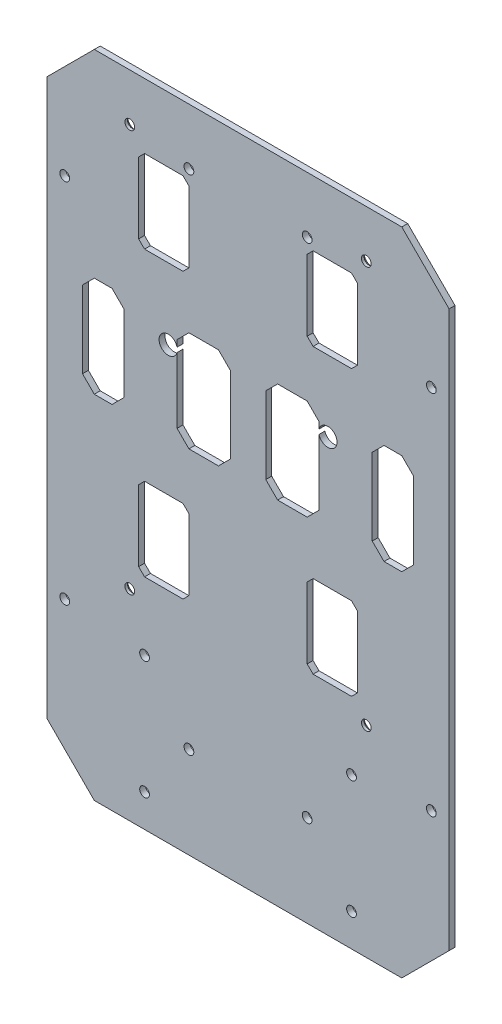
from build123d import *

# Parameters (mm, degrees)
SKETCH_6_R               = 1.65
EXTRUDE_401_DEPTH        = 2
SKETCH_7_R               = 3.1
CUT_EXTRUDE_474_DEPTH    = 2
SKETCH_8_R               = 2.75
D5P5_1P1_DEPTH           = 1.1
D5P5_1P1_DRAFT           = 45
D5P5_1P1_PROFILE_2_DEPTH = 1.1
D5P5_1P1_PROFILE_2_DRAFT = 45
D5P5_1P1_PROFILE_3_DEPTH = 1.1
D5P5_1P1_PROFILE_3_DRAFT = 45
D5P5_1P1_PROFILE_4_DEPTH = 1.1
D5P5_1P1_PROFILE_4_DRAFT = 45


with BuildPart() as part:
    # 草图6 → Extrude 401 (new body)
    with BuildSketch(Plane.XY):
        Polygon((-52, -116), (52, -116), (68, -100), (68, 88), (52, 104), (-52, 104), (-68, 88), (-68, -100), align=None)
        with Locations((-20, -85)):
            Circle(SKETCH_6_R, mode=Mode.SUBTRACT)
        with Locations((-62, -62)):
            Circle(SKETCH_6_R, mode=Mode.SUBTRACT)
        with Locations((-40, -48)):
            Circle(SKETCH_6_R, mode=Mode.SUBTRACT)
        with Locations((-35, -105)):
            Circle(SKETCH_6_R, mode=Mode.SUBTRACT)
        with Locations((-20, 85)):
            Circle(SKETCH_6_R, mode=Mode.SUBTRACT)
        with Locations((-62, 62)):
            Circle(SKETCH_6_R, mode=Mode.SUBTRACT)
        with Locations((-40, 88)):
            Circle(SKETCH_6_R, mode=Mode.SUBTRACT)
        with Locations((-35, -65)):
            Circle(SKETCH_6_R, mode=Mode.SUBTRACT)
        with Locations((20, -85)):
            Circle(SKETCH_6_R, mode=Mode.SUBTRACT)
        with Locations((62, -62)):
            Circle(SKETCH_6_R, mode=Mode.SUBTRACT)
        with Locations((40, -48)):
            Circle(SKETCH_6_R, mode=Mode.SUBTRACT)
        with Locations((35, -105)):
            Circle(SKETCH_6_R, mode=Mode.SUBTRACT)
        with Locations((20, 85)):
            Circle(SKETCH_6_R, mode=Mode.SUBTRACT)
        with Locations((62, 62)):
            Circle(SKETCH_6_R, mode=Mode.SUBTRACT)
        with Locations((40, 88)):
            Circle(SKETCH_6_R, mode=Mode.SUBTRACT)
        with Locations((35, -65)):
            Circle(SKETCH_6_R, mode=Mode.SUBTRACT)
        Polygon((-35, -42), (-22, -42), (-20, -40), (-20, -16), (-22, -14), (-35, -14), (-37, -16), (-37, -40), align=None, mode=Mode.SUBTRACT)
        Polygon((-35, 54), (-22, 54), (-20, 56), (-20, 80), (-22, 82), (-35, 82), (-37, 80), (-37, 56), align=None, mode=Mode.SUBTRACT)
        Polygon((22, -42), (35, -42), (37, -40), (37, -16), (35, -14), (22, -14), (20, -16), (20, -40), align=None, mode=Mode.SUBTRACT)
        Polygon((22, 54), (35, 54), (37, 56), (37, 80), (35, 82), (22, 82), (20, 80), (20, 56), align=None, mode=Mode.SUBTRACT)
        Polygon((-20, 3), (-10, 3), (-6, 7), (-6, 33), (-10, 37), (-20, 37), (-24, 33), (-24, 7), align=None, mode=Mode.SUBTRACT)
        Polygon((-52, 3), (-46, 3), (-42, 7), (-42, 33), (-46, 37), (-52, 37), (-56, 33), (-56, 7), align=None, mode=Mode.SUBTRACT)
        Polygon((10, 3), (20, 3), (24, 7), (24, 33), (20, 37), (10, 37), (6, 33), (6, 7), align=None, mode=Mode.SUBTRACT)
        Polygon((46, 3), (52, 3), (56, 7), (56, 33), (52, 37), (46, 37), (42, 33), (42, 7), align=None, mode=Mode.SUBTRACT)
    extrude(amount=EXTRUDE_401_DEPTH)

    # 草图7 → Cut-Extrude 474 (cut)
    with BuildSketch(Plane.XY):
        with Locations((-27, -30)):
            Circle(SKETCH_7_R)
        with Locations((-27, 30)):
            Circle(SKETCH_7_R)
        with Locations((27, -30)):
            Circle(SKETCH_7_R)
        with Locations((27, 30)):
            Circle(SKETCH_7_R)
    extrude(amount=CUT_EXTRUDE_474_DEPTH, mode=Mode.SUBTRACT)


with BuildPart() as d5p5_1p1_tool:
    # 草图8 → 侧鞍下沉头孔_D5p5深1p1 (with draft: the straight prism first)
    with BuildSketch(Plane.XY):
        with Locations((-40, -48)):
            Circle(SKETCH_8_R)
    extrude(amount=D5P5_1P1_DEPTH)
    # 侧鞍下沉头孔_D5p5深1p1: the draft: its side faces are tilted about the plane it starts from
    d5p5_1p1_sides = [d5p5_1p1_tool.faces().sort_by_distance(p)[0] for p in [
        (-42.75, -48, 0.55),
    ]]
    draft(d5p5_1p1_sides, Plane.XY, D5P5_1P1_DRAFT)


with BuildPart() as part_1:
    add(part.part)

    # 侧鞍下沉头孔_D5p5深1p1: cut by d5p5_1p1_tool
    add(d5p5_1p1_tool.part, mode=Mode.SUBTRACT)


with BuildPart() as d5p5_1p1_profile_2_tool:
    # 草图8 → 侧鞍下沉头孔_D5p5深1p1 profile 2 (with draft: the straight prism first)
    with BuildSketch(Plane.XY):
        with Locations((-40, 88)):
            Circle(SKETCH_8_R)
    extrude(amount=D5P5_1P1_PROFILE_2_DEPTH)
    # 侧鞍下沉头孔_D5p5深1p1 profile 2: the draft: its side faces are tilted about the plane it starts from
    d5p5_1p1_profile_2_sides = [d5p5_1p1_profile_2_tool.faces().sort_by_distance(p)[0] for p in [
        (-42.75, 88, 0.55),
    ]]
    draft(d5p5_1p1_profile_2_sides, Plane.XY, D5P5_1P1_PROFILE_2_DRAFT)


with BuildPart() as part_2:
    add(part_1.part)

    # 侧鞍下沉头孔_D5p5深1p1 profile 2: cut by d5p5_1p1_profile_2_tool
    add(d5p5_1p1_profile_2_tool.part, mode=Mode.SUBTRACT)


with BuildPart() as d5p5_1p1_profile_3_tool:
    # 草图8 → 侧鞍下沉头孔_D5p5深1p1 profile 3 (with draft: the straight prism first)
    with BuildSketch(Plane.XY):
        with Locations((40, -48)):
            Circle(SKETCH_8_R)
    extrude(amount=D5P5_1P1_PROFILE_3_DEPTH)
    # 侧鞍下沉头孔_D5p5深1p1 profile 3: the draft: its side faces are tilted about the plane it starts from
    d5p5_1p1_profile_3_sides = [d5p5_1p1_profile_3_tool.faces().sort_by_distance(p)[0] for p in [
        (37.25, -48, 0.55),
    ]]
    draft(d5p5_1p1_profile_3_sides, Plane.XY, D5P5_1P1_PROFILE_3_DRAFT)


with BuildPart() as part_3:
    add(part_2.part)

    # 侧鞍下沉头孔_D5p5深1p1 profile 3: cut by d5p5_1p1_profile_3_tool
    add(d5p5_1p1_profile_3_tool.part, mode=Mode.SUBTRACT)


with BuildPart() as d5p5_1p1_profile_4_tool:
    # 草图8 → 侧鞍下沉头孔_D5p5深1p1 profile 4 (with draft: the straight prism first)
    with BuildSketch(Plane.XY):
        with Locations((40, 88)):
            Circle(SKETCH_8_R)
    extrude(amount=D5P5_1P1_PROFILE_4_DEPTH)
    # 侧鞍下沉头孔_D5p5深1p1 profile 4: the draft: its side faces are tilted about the plane it starts from
    d5p5_1p1_profile_4_sides = [d5p5_1p1_profile_4_tool.faces().sort_by_distance(p)[0] for p in [
        (37.25, 88, 0.55),
    ]]
    draft(d5p5_1p1_profile_4_sides, Plane.XY, D5P5_1P1_PROFILE_4_DRAFT)


with BuildPart() as part_4:
    add(part_3.part)

    # 侧鞍下沉头孔_D5p5深1p1 profile 4: cut by d5p5_1p1_profile_4_tool
    add(d5p5_1p1_profile_4_tool.part, mode=Mode.SUBTRACT)


solid = part_4.part
